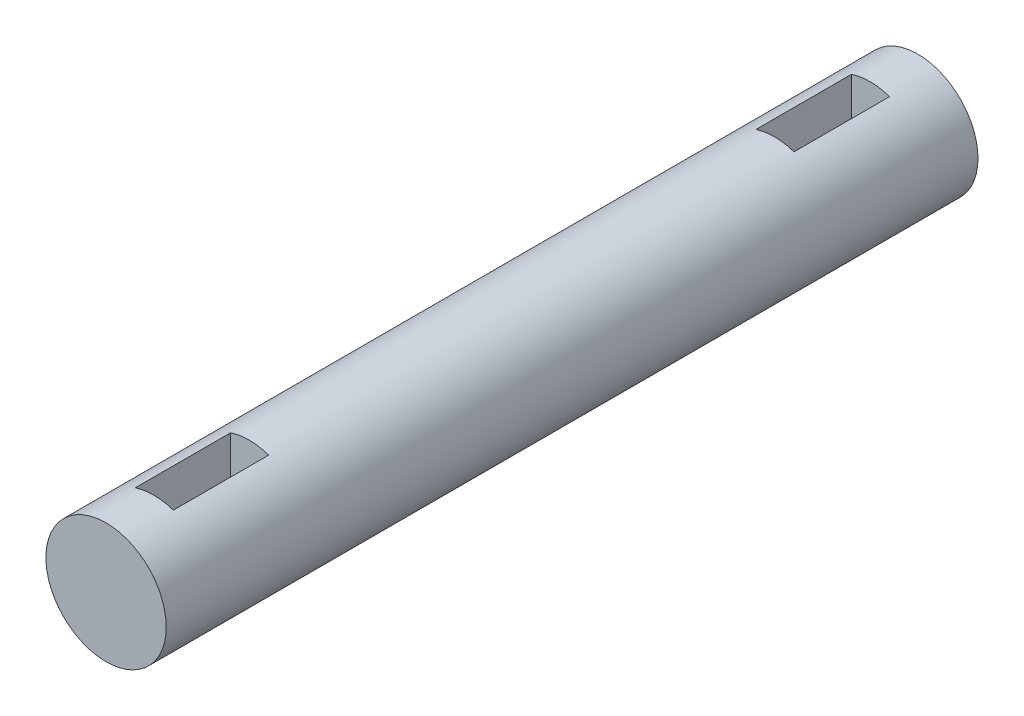
from build123d import *

# Parameters (mm, degrees)
BOSS_EXTRUDE1_DEPTH      = 80
BOSS_EXTRUDE1_DEPTH_BACK = 5
SKETCH1_R                = 6.3
CUT_EXTRUDE1_DEPTH       = 10


with BuildPart() as part:
    # Sketch1 → Boss-Extrude1 (new, two sides: drawn at the far end of the back side and taken through both)
    with BuildSketch(Plane.XY.offset(-BOSS_EXTRUDE1_DEPTH_BACK)):
        Circle(SKETCH1_R)
    extrude(amount=BOSS_EXTRUDE1_DEPTH + BOSS_EXTRUDE1_DEPTH_BACK)

    # Sketch6 → Cut-Extrude1 (cut)
    with BuildSketch(Plane(origin=(0, 0, 0), x_dir=(1, 0, 0), z_dir=(0, 1, 0))):
        Polygon((-1.955160092, -70), (-1.955160092, -65.008101893), (0, -65.008101893), (2.038358394, -65.008101893), (2.038358394, -74.991898107), (-1.955160092, -74.991898107), align=None)
        Polygon((0, 0), (-1.955160092, 0), (-1.955160092, -10), (2.038358394, -10), (2.038358394, 0), align=None)
    extrude(amount=CUT_EXTRUDE1_DEPTH, mode=Mode.SUBTRACT)


solid = part.part
